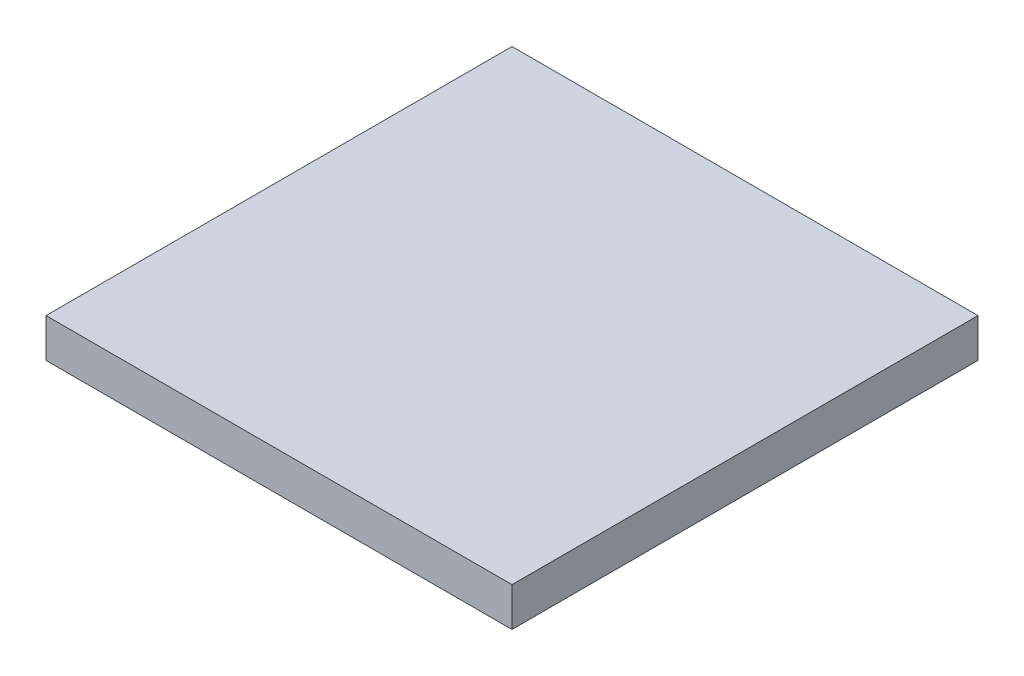
from build123d import *

# Parameters (mm, degrees)
SCHIZZO2_W                   = 120
SCHIZZO2_H                   = 120
ESTRUSIONE_ESTRUSIONE2_DEPTH = 10


with BuildPart() as part:
    # Schizzo2 → Estrusione-Estrusione2 (new body)
    with BuildSketch(Plane(origin=(0, 0, 0), x_dir=(1, 0, 0), z_dir=(0, 1, 0))):
        with Locations((57.336140445, -89.689917766)):
            Rectangle(SCHIZZO2_W, SCHIZZO2_H)
    extrude(amount=ESTRUSIONE_ESTRUSIONE2_DEPTH)


solid = part.part
